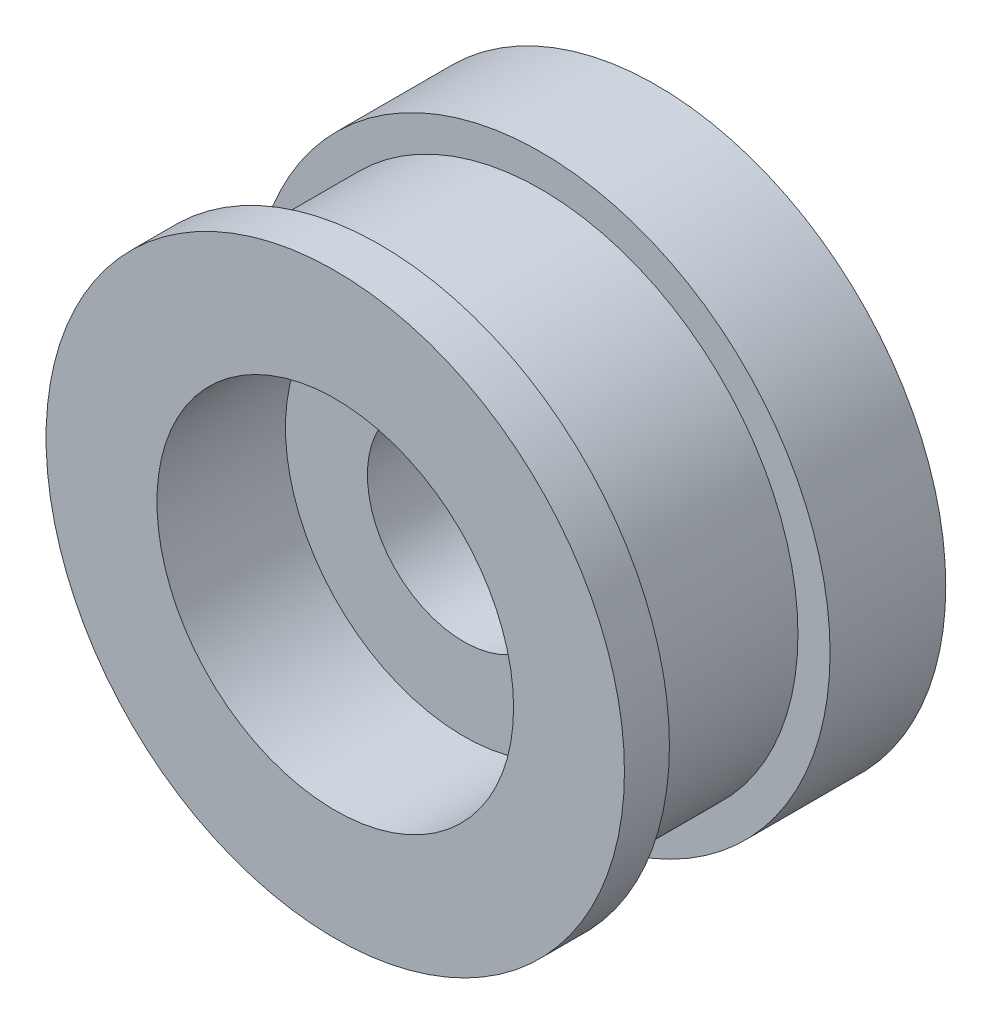
from build123d import *

# Parameters (mm, degrees)
BASE_R                   = 4.5
BODY_1_DEPTH             = 1.8
THIN_BASE_R              = 4
BODY_THIN_DEPTH          = 2.5
BASE_2_R                 = 4.5
BODY_2_DEPTH             = 0.7
SCREW_HEAD_HOLE_SKETCH_R = 2.775
SCREW_HEAD_HOLE_DEPTH    = 2
F_3_0_3_DIAMETER_HOLE1_D = 3


with BuildPart() as part:
    # base → body 1 (new body)
    with BuildSketch(Plane.XY):
        Circle(BASE_R)
    extrude(amount=BODY_1_DEPTH)

    # thin base → body thin (add)
    with BuildSketch(Plane.XY.offset(1.8)):
        Circle(THIN_BASE_R)
    extrude(amount=BODY_THIN_DEPTH)

    # base 2 → body 2 (add)
    with BuildSketch(Plane.XY.offset(4.3)):
        Circle(BASE_2_R)
    extrude(amount=BODY_2_DEPTH)

    # screw head hole sketch → screw head hole (cut)
    with BuildSketch(Plane.XY.offset(5)):
        Circle(SCREW_HEAD_HOLE_SKETCH_R)
    extrude(amount=-SCREW_HEAD_HOLE_DEPTH, mode=Mode.SUBTRACT)

    # Ø3.0 (3) Diameter Hole1 (through all)
    with Locations(Plane.XY.offset(3)):
        with Locations((0, 0)):
            Hole(F_3_0_3_DIAMETER_HOLE1_D / 2)


solid = part.part
